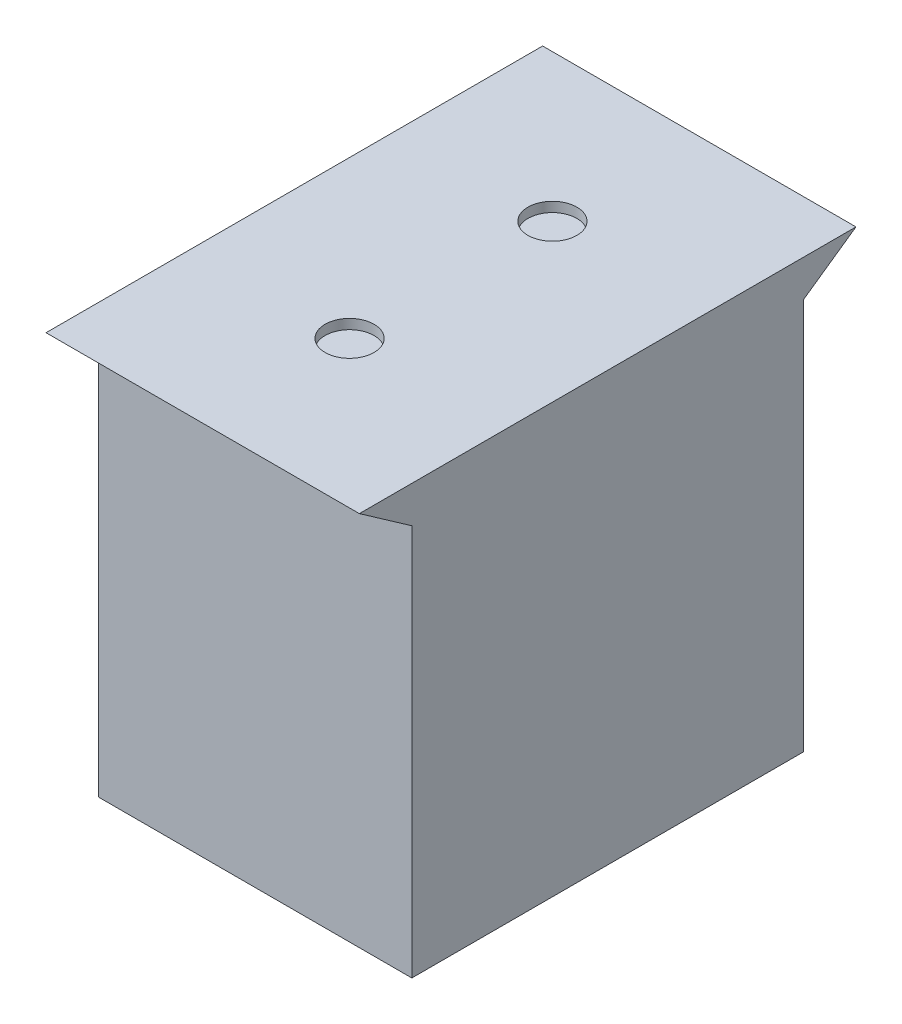
from build123d import *

# Parameters (mm, degrees)
SKETCH1_W           = 4.064
SKETCH1_H           = 5.08
BOSS_EXTRUDE1_DEPTH = 5.08
BOSS_EXTRUDE3_DEPTH = 4.064
SKETCH5_R           = 0.3175
CUT_EXTRUDE2_DEPTH  = 0.127


with BuildPart() as part:
    # Sketch1 → Boss-Extrude1 (new body)
    with BuildSketch(Plane(origin=(0, 0, 0), x_dir=(1, 0, 0), z_dir=(0, 1, 0))):
        Rectangle(SKETCH1_W, SKETCH1_H)
    extrude(amount=BOSS_EXTRUDE1_DEPTH)

    # Sketch4 → Boss-Extrude3 (add)
    with BuildSketch(Plane.ZY.offset(2.032)):
        Polygon((-2.54, 5.08), (-3.220564847, 5.556536636), (3.220564847, 5.556536636), (2.54, 5.08), align=None)
    extrude(amount=-BOSS_EXTRUDE3_DEPTH)

    # Sketch5 → Cut-Extrude2 (cut)
    with BuildSketch(Plane(origin=(0, 5.556536636, 0), x_dir=(1, 0, 0), z_dir=(0, 1, 0))):
        with Locations(Location((0, 1.315564847, 0), (0, 0, 270))):
            Circle(SKETCH5_R)
        with Locations(Location((0, -1.315564847, 0), (0, 0, 90))):
            Circle(SKETCH5_R)
    extrude(amount=-CUT_EXTRUDE2_DEPTH, mode=Mode.SUBTRACT)


solid = part.part
